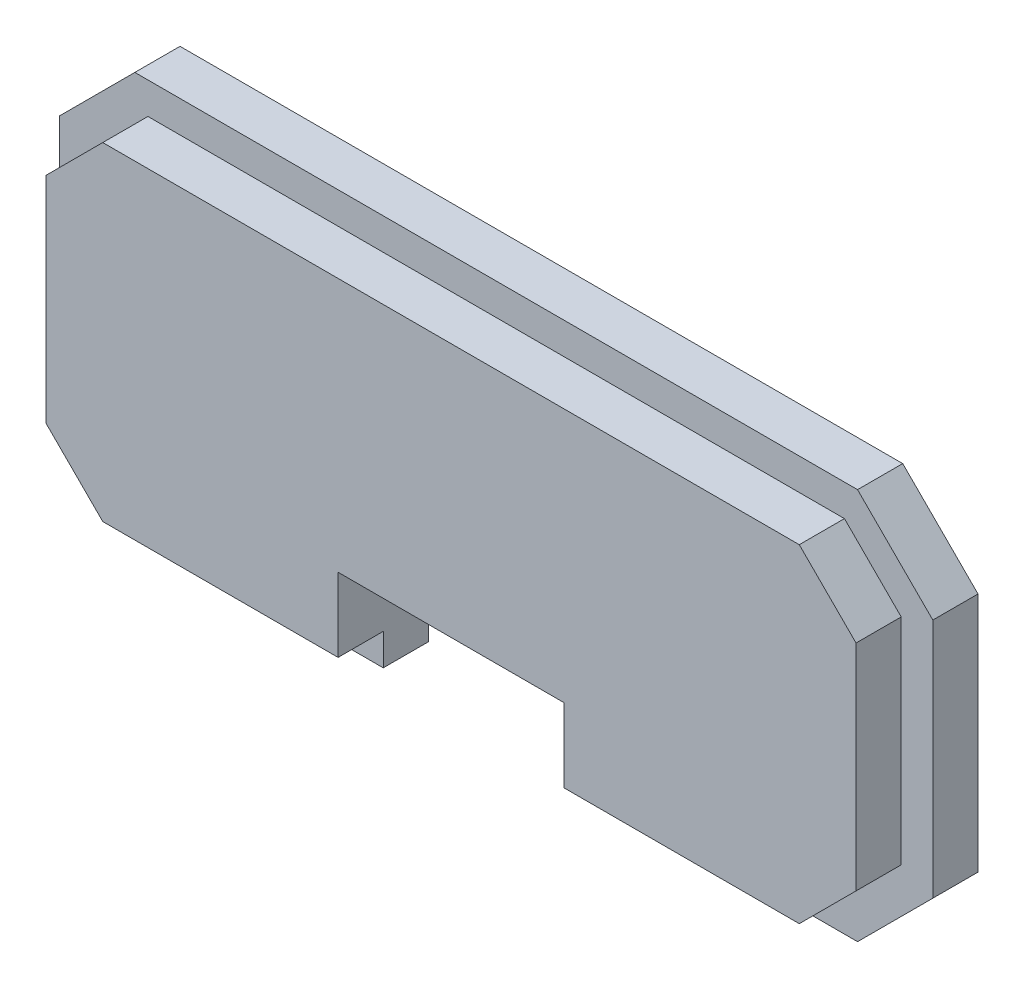
from build123d import *

# Parameters (mm, degrees)
PANEL_DEPTH        = 3
INSERT_DEPTH       = 3
SKETCH3_W          = 15
SKETCH3_H          = 7
CUT_EXTRUDE1_DEPTH = 256.411638929


with BuildPart() as part:
    # Sketch1 → panel (new body)
    with BuildSketch(Plane.XY):
        Polygon((-232.020441826, 85.609661267), (-232.020441826, 101.609661267), (-227.020441826, 106.609661267), (-179.020441826, 106.609661267), (-174.020441826, 101.609661267), (-174.020441826, 85.609661267), (-179.020441826, 80.609661267), (-227.020441826, 80.609661267), align=None)
    extrude(amount=PANEL_DEPTH)

    # Sketch2 → insert (add)
    with BuildSketch(Plane(origin=(0, 0, 3), x_dir=(-1, 0, 0), z_dir=(0, 0, -1))):
        Polygon((176.120441826, 86.479509748), (176.120441826, 100.739812786), (179.890290307, 104.509661267), (226.150593345, 104.509661267), (229.920441826, 100.739812786), (229.920441826, 86.479509748), (226.150593345, 82.709661267), (179.890290307, 82.709661267), align=None)
    extrude(amount=-INSERT_DEPTH)

    # Sketch3 → Cut-Extrude1 (cut, through all)
    with BuildSketch(Plane.XY):
        with Locations((-203.020441826, 84.109661267)):
            Rectangle(SKETCH3_W, SKETCH3_H)
    extrude(amount=CUT_EXTRUDE1_DEPTH, mode=Mode.SUBTRACT)


solid = part.part
